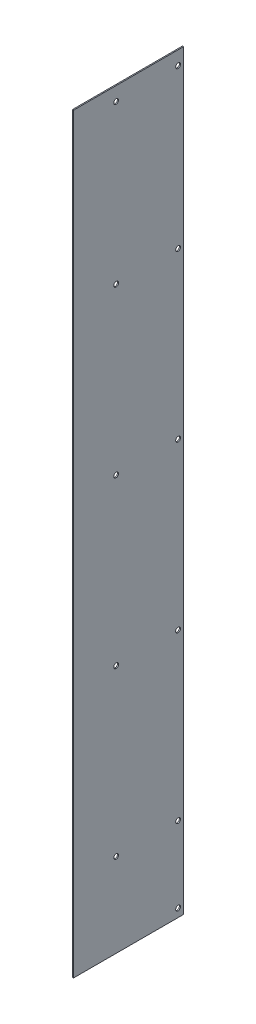
from build123d import *

# Parameters (mm, degrees)
SKETCH1_W                         = 160
SKETCH1_H                         = 1092
BOSS_EXTRUDE1_DEPTH               = 1.6
F_7_0_7_DIAMETER_HOLE1_D          = 7
F_7_0_7_DIAMETER_HOLE1_DEPTH      = 12
F_7_0_7_DIAMETER_HOLE1_TIP        = 2.103012167
F_7_0_7_DIAMETER_HOLE3_AT_2_COUNT = 2
F_7_0_7_DIAMETER_HOLE3_AT_2_PITCH = 90
LPATTERN1_COUNT                   = 4
LPATTERN1_PITCH                   = 240


with BuildPart() as part:
    # Sketch1 → Boss-Extrude1 (new body)
    with BuildSketch(Plane(origin=(0, 0, 0), x_dir=(0, 0, -1), z_dir=(1, 0, 0))):
        with Locations((80, 546)):
            Rectangle(SKETCH1_W, SKETCH1_H)
    extrude(amount=BOSS_EXTRUDE1_DEPTH)

    # Ø7.0 (7) Diameter Hole1
    with Locations(Plane.ZY):
        with Locations((-152, 12), (-152, 1072), (-62, 1072)):
            Hole(F_7_0_7_DIAMETER_HOLE1_D / 2, depth=F_7_0_7_DIAMETER_HOLE1_DEPTH)
            with Locations((0, 0, -(F_7_0_7_DIAMETER_HOLE1_DEPTH + F_7_0_7_DIAMETER_HOLE1_TIP / 2))):  # 118° drill point
                Cone(0, F_7_0_7_DIAMETER_HOLE1_D / 2, F_7_0_7_DIAMETER_HOLE1_TIP, mode=Mode.SUBTRACT)

    # Sketch4 → Ø7.0 (7) Diameter Hole3 (revolve, cut)
    with BuildSketch(Plane(origin=(0, 122, -152), x_dir=(0, 0, 1), z_dir=(0, 1, 0))):
        Polygon((0, 0), (0, 14.103012167), (3.5, 12), (3.5, 0), align=None)
    f_7_0_7_diameter_hole3 = revolve(axis=Axis((-6.35, 122, -152), (1, 0, 0)), mode=Mode.SUBTRACT)

    # Ø7.0 (7) Diameter Hole3 at 2: Ø7.0 (7) Diameter Hole3 ×2
    with Locations(*[(0, 0, i * F_7_0_7_DIAMETER_HOLE3_AT_2_PITCH) for i in range(1, F_7_0_7_DIAMETER_HOLE3_AT_2_COUNT)]):
        add(f_7_0_7_diameter_hole3, mode=Mode.SUBTRACT)

    # LPattern1: Ø7.0 (7) Diameter Hole3 ×4
    with Locations(*[(0, i * LPATTERN1_PITCH, 0) for i in range(1, LPATTERN1_COUNT)]):
        add(f_7_0_7_diameter_hole3, mode=Mode.SUBTRACT)

    # LPattern1 copy 1 sketch → LPattern1 copy 1 (revolve, cut)
    with BuildSketch(Plane(origin=(0, 362, -62), x_dir=(0, 0, 1), z_dir=(0, 1, 0))):
        Polygon((0, 0), (0, 14.103012167), (3.5, 12), (3.5, 0), align=None)
    revolve(axis=Axis((-6.35, 362, -62), (1, 0, 0)), mode=Mode.SUBTRACT)

    # LPattern1 copy 2 sketch → LPattern1 copy 2 (revolve, cut)
    with BuildSketch(Plane(origin=(0, 602, -62), x_dir=(0, 0, 1), z_dir=(0, 1, 0))):
        Polygon((0, 0), (0, 14.103012167), (3.5, 12), (3.5, 0), align=None)
    revolve(axis=Axis((-6.35, 602, -62), (1, 0, 0)), mode=Mode.SUBTRACT)

    # LPattern1 copy 3 sketch → LPattern1 copy 3 (revolve, cut)
    with BuildSketch(Plane(origin=(0, 842, -62), x_dir=(0, 0, 1), z_dir=(0, 1, 0))):
        Polygon((0, 0), (0, 14.103012167), (3.5, 12), (3.5, 0), align=None)
    revolve(axis=Axis((-6.35, 842, -62), (1, 0, 0)), mode=Mode.SUBTRACT)


solid = part.part
